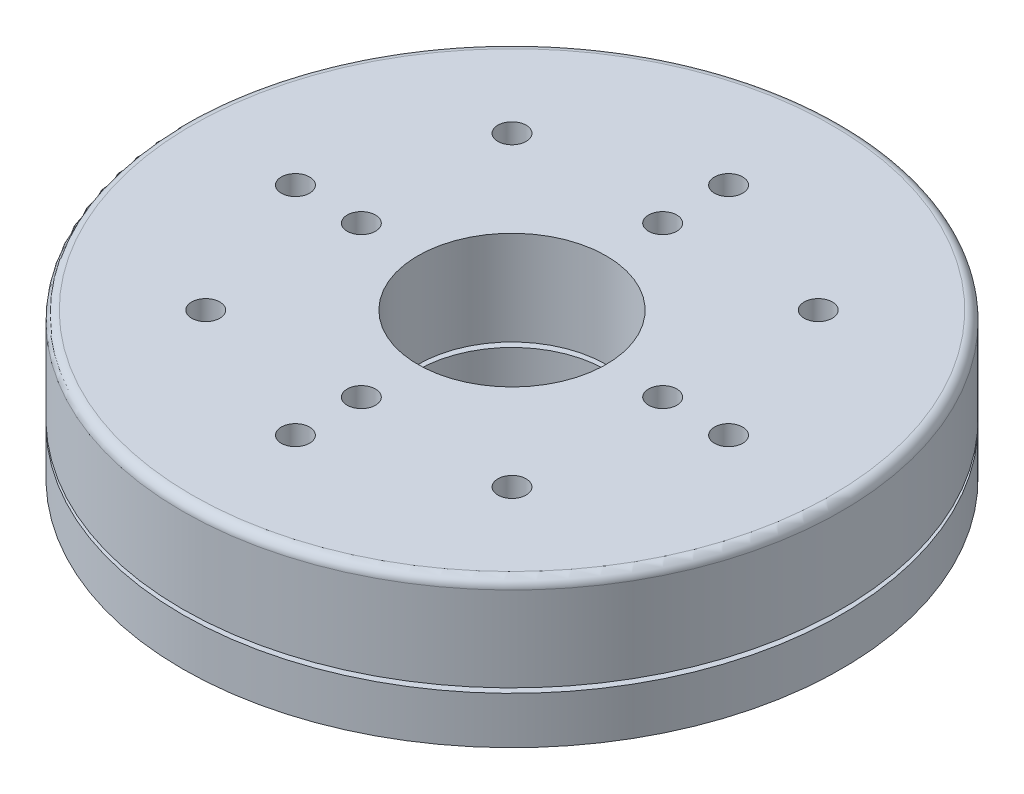
from build123d import *

# Parameters (mm, degrees)
SKETCH_1_R               = 35
EXTRUDE_1_DEPTH          = 10
FILLET_1_R               = 1
SKETCH_2_R               = 35
EXTRUDE_2_DEPTH          = 5
SKETCH_3_R               = 1.5
CUT_EXTRUDE_1_DEPTH      = 5
CUT_EXTRUDE_3_DEPTH      = 51.59891317
CUT_EXTRUDE_3_DEPTH_BACK = 51.59891317
SKETCH_5_R               = 10


with BuildPart() as part:
    # 草图1 → 凸台-拉伸1 (new body)
    with BuildSketch(Plane(origin=(0, 0, 0), x_dir=(1, 0, 0), z_dir=(0, 1, 0))):
        with Locations(Location((0, 0, 0), (0, 0, 270))):
            Circle(SKETCH_1_R)
    extrude(amount=EXTRUDE_1_DEPTH)

    # 圆角1
    fillet_1_edges = [part.edges().sort_by_distance(p)[0] for p in [
        (0, 10, -35),
    ]]
    fillet(fillet_1_edges, radius=FILLET_1_R)

    # 草图3 → 切除-拉伸1 (cut)
    with BuildSketch(Plane(origin=(0, 10, 0), x_dir=(1, 0, 0), z_dir=(0, 1, 0))):
        with Locations(Location((-23, 0, 0), (0, 0, 270))):
            Circle(SKETCH_3_R)
        with Locations(Location((-16, 0, 0), (0, 0, 270))):
            Circle(SKETCH_3_R)
        with Locations(Location((0.001, 16.001, 0), (0, 0, 270))):
            Circle(SKETCH_3_R)
        with Locations(Location((16.002, 0, 0), (0, 0, 270))):
            Circle(SKETCH_3_R)
        with Locations(Location((0.001, -16.001, 0), (0, 0, 270))):
            Circle(SKETCH_3_R)
        with Locations(Location((-16.263455967, 16.263455967, 0), (0, 0, 270))):
            Circle(SKETCH_3_R)
        with Locations(Location((0, 23, 0), (0, 0, 270))):
            Circle(SKETCH_3_R)
        with Locations(Location((16.263455967, 16.263455967, 0), (0, 0, 270))):
            Circle(SKETCH_3_R)
        with Locations(Location((23, 0, 0), (0, 0, 270))):
            Circle(SKETCH_3_R)
        with Locations(Location((16.263455967, -16.263455967, 0), (0, 0, 270))):
            Circle(SKETCH_3_R)
        with Locations(Location((0, -23, 0), (0, 0, 270))):
            Circle(SKETCH_3_R)
        with Locations(Location((-16.263455967, -16.263455967, 0), (0, 0, 270))):
            Circle(SKETCH_3_R)
    extrude(amount=-CUT_EXTRUDE_1_DEPTH, mode=Mode.SUBTRACT)


with BuildPart() as body_2:
    # 草图2 → 凸台-拉伸2 (new body)
    with BuildSketch(Plane(origin=(0, -0.5, 0), x_dir=(-1, 0, 0), z_dir=(0, -1, 0))):
        with Locations(Location((0, 0, 0), (0, 0, 90))):
            Circle(SKETCH_2_R)
    extrude(amount=EXTRUDE_2_DEPTH)


with BuildPart() as cut_extrude_3_tool:
    # 草图5 → 切除-拉伸3 (new, two sides: drawn at the far end of the back side and taken through both)
    with BuildSketch(Plane(origin=(0, -0.5, 0), x_dir=(-1, 0, 0), z_dir=(0, -1, 0)).offset(-CUT_EXTRUDE_3_DEPTH_BACK)):
        with Locations(Location((0, 0, 0), (0, 0, 90))):
            Circle(SKETCH_5_R)
    extrude(amount=CUT_EXTRUDE_3_DEPTH + CUT_EXTRUDE_3_DEPTH_BACK)


with BuildPart() as part_1:
    add(part.part)

    # 切除-拉伸3: cut by cut_extrude_3_tool
    add(cut_extrude_3_tool.part, mode=Mode.SUBTRACT)


with BuildPart() as body_2_1:
    add(body_2.part)

    # 切除-拉伸3: cut by cut_extrude_3_tool
    add(cut_extrude_3_tool.part, mode=Mode.SUBTRACT)


solid = Compound([part_1.part, body_2_1.part])
